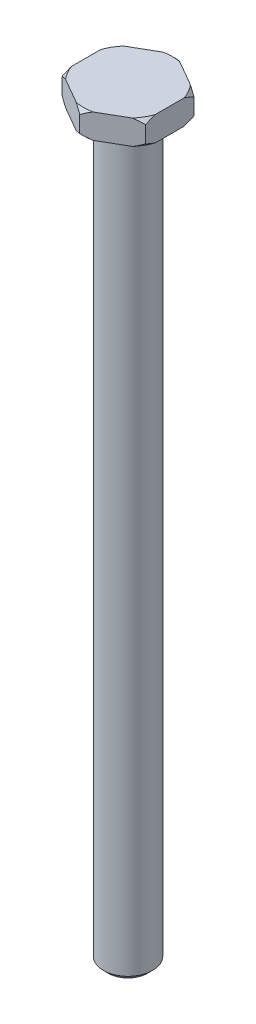
from build123d import *

# Parameters (mm, degrees)
CUT_EXTRUDE1_REACH = 157.644
SKETCH3_R          = 15.443252693


with BuildPart() as part:
    # Sketch2 → Revolve1 (revolve)
    with BuildSketch(Plane(origin=(0, 0, 0), x_dir=(0, 0, -1), z_dir=(1, 0, 0))):
        Polygon((-10, 76.5), (-10, 73.5), (-9, 72.5), (-5, 72.5), (-5, -76.5), (-4, -77.5), (0, -77.5), (0, 77.5), (-9, 77.5), align=None)
    revolve(axis=Axis((0, 23.60486684, 0), (0, -1, 0)))

    # Cut-Extrude1: up to this face of the body (flat: up to its plane)
    cut_extrude1_end = Plane(part.part.faces().sort_by_distance((0, 72.5, -8.745441559))[0])
    # Sketch3 → Cut-Extrude1 (cut, up to the picked face)
    with BuildSketch(Plane(origin=(0, 77.5, 0), x_dir=(1, 0, 0), z_dir=(0, 1, 0)), mode=Mode.PRIVATE) as cut_extrude1_sk1:
        Circle(SKETCH3_R)
        Polygon((0, -9.814954576), (8.5, -4.907477288), (8.5, 4.907477288), (0, 9.814954576), (-8.5, 4.907477288), (-8.5, -4.907477288), align=None, mode=Mode.SUBTRACT)
    cut_extrude1_tool1 = split(extrude(cut_extrude1_sk1.sketch, amount=-CUT_EXTRUDE1_REACH, mode=Mode.PRIVATE), bisect_by=cut_extrude1_end, keep=Keep.BOTH, mode=Mode.PRIVATE)
    add(cut_extrude1_tool1.solids().sort_by(Axis((-15.006452, 77.5, 0), (0, -1, 0)))[0], mode=Mode.SUBTRACT)


solid = part.part
